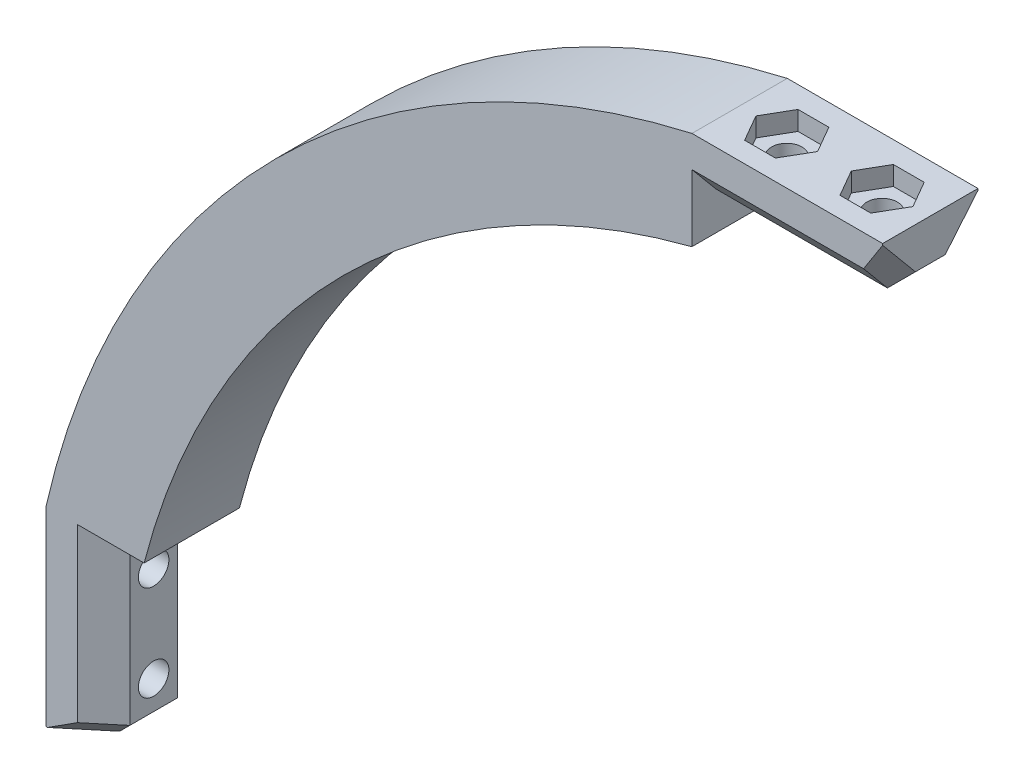
from build123d import *

# Parameters (mm, degrees)
BOSS_EXTRU_1_DEPTH      = 10
ENL_V_MAT_EXTRU_1_DEPTH = 20
ENL_V_MAT_EXTRU_2_DEPTH = 20
ESQUISSE5_R             = 1.6
ENL_V_MAT_EXTRU_3_DEPTH = 20
ESQUISSE6_R             = 1.6
ENL_V_MAT_EXTRU_4_DEPTH = 20
CHANFREIN1_SIZE         = 2
ENL_V_MAT_EXTRU_5_DEPTH = 2
ENL_V_MAT_EXTRU_6_DEPTH = 2


with BuildPart() as part:
    # Esquisse1 → Boss.-Extru.1 (new body)
    with BuildSketch(Plane.XY):
        with BuildLine():
            Line((-20, 87.749643874), (0, 87.749643874))
            Line((0, 87.749643874), (0, 77.459666924))
            Line((0, 77.459666924), (-20, 77.459666924))
            ThreePointArc((-20, 77.459666924), (-56.568542495, 56.568542495), (-77.459666924, 20))
            Line((-77.459666924, 20), (-77.459666924, 0))
            Line((-77.459666924, 0), (-87.749643874, 0))
            Line((-87.749643874, 0), (-87.749643874, 20))
            ThreePointArc((-87.749643874, 20), (-63.639610307, 63.639610307), (-20, 87.749643874))
        make_face()
    extrude(amount=BOSS_EXTRU_1_DEPTH)

    # Esquisse2 → Enlèv. mat.-Extru.1 (cut)
    with BuildSketch(Plane.XZ):
        Polygon((-84.459666924, 10), (-77.459666924, 10), (-77.459666924, 0), (-84.459666924, 0), (-81.459666924, 2.5), (-81.459666924, 7.5), align=None)
    extrude(amount=-ENL_V_MAT_EXTRU_1_DEPTH, mode=Mode.SUBTRACT)

    # Esquisse4 → Enlèv. mat.-Extru.2 (cut)
    with BuildSketch(Plane(origin=(0, 0, 0), x_dir=(0, 0, -1), z_dir=(1, 0, 0))):
        Polygon((0, 84.459666924), (0, 77.459666924), (-10, 77.459666924), (-10, 84.459666924), (-7.5, 81.459666924), (-2.5, 81.459666924), align=None)
    extrude(amount=-ENL_V_MAT_EXTRU_2_DEPTH, mode=Mode.SUBTRACT)

    # Esquisse5 → Enlèv. mat.-Extru.3 (cut)
    with BuildSketch(Plane(origin=(-81.459666924, 0, 0), x_dir=(0, 0, -1), z_dir=(1, 0, 0))):
        with Locations(Location((-5, 5, 0), (0, 0, 90))):
            Circle(ESQUISSE5_R)
        with Locations(Location((-5, 15, 0), (0, 0, 90))):
            Circle(ESQUISSE5_R)
    extrude(amount=-ENL_V_MAT_EXTRU_3_DEPTH, mode=Mode.SUBTRACT)

    # Esquisse6 → Enlèv. mat.-Extru.4 (cut)
    with BuildSketch(Plane.XZ.offset(-81.459666924)):
        with Locations(Location((-5, 5.05896145, 0), (0, 0, 270))):
            Circle(ESQUISSE6_R)
        with Locations(Location((-15, 5.05896145, 0), (0, 0, 270))):
            Circle(ESQUISSE6_R)
    extrude(amount=-ENL_V_MAT_EXTRU_4_DEPTH, mode=Mode.SUBTRACT)

    # Chanfrein1
    chanfrein1_edges = [part.edges().sort_by_distance(p)[0] for p in [
        (-82.959666924, 0, 8.75),
        (-81.459666924, 0, 5),
        (-82.959666924, 0, 1.25),
        (0, 82.959666924, 1.25),
        (0, 81.459666924, 5),
        (0, 82.959666924, 8.75),
    ]]
    chamfer(chanfrein1_edges, length=CHANFREIN1_SIZE)

    # Esquisse7 → Enlèv. mat.-Extru.5 (cut)
    with BuildSketch(Plane.ZY.offset(87.749643874)):
        Polygon((2.2, 6.616580754), (2.2, 3.383419246), (5, 1.766838493), (7.8, 3.383419246), (7.8, 6.616580754), (5, 8.233161507), align=None)
        Polygon((7.8, 16.616580754), (5, 18.233161507), (2.2, 16.616580754), (2.2, 13.383419246), (5, 11.766838493), (7.8, 13.383419246), align=None)
    extrude(amount=-ENL_V_MAT_EXTRU_5_DEPTH, mode=Mode.SUBTRACT)

    # Esquisse8 → Enlèv. mat.-Extru.6 (cut)
    with BuildSketch(Plane(origin=(0, 87.749643874, 0), x_dir=(1, 0, 0), z_dir=(0, 1, 0))):
        Polygon((-3.383419246, -2.25896145), (-6.616580754, -2.25896145), (-8.233161507, -5.05896145), (-6.616580754, -7.85896145), (-3.383419246, -7.85896145), (-1.766838493, -5.05896145), align=None)
        Polygon((-13.383419246, -2.25896145), (-16.616580754, -2.25896145), (-18.233161507, -5.05896145), (-16.616580754, -7.85896145), (-13.383419246, -7.85896145), (-11.766838493, -5.05896145), align=None)
    extrude(amount=-ENL_V_MAT_EXTRU_6_DEPTH, mode=Mode.SUBTRACT)


solid = part.part
